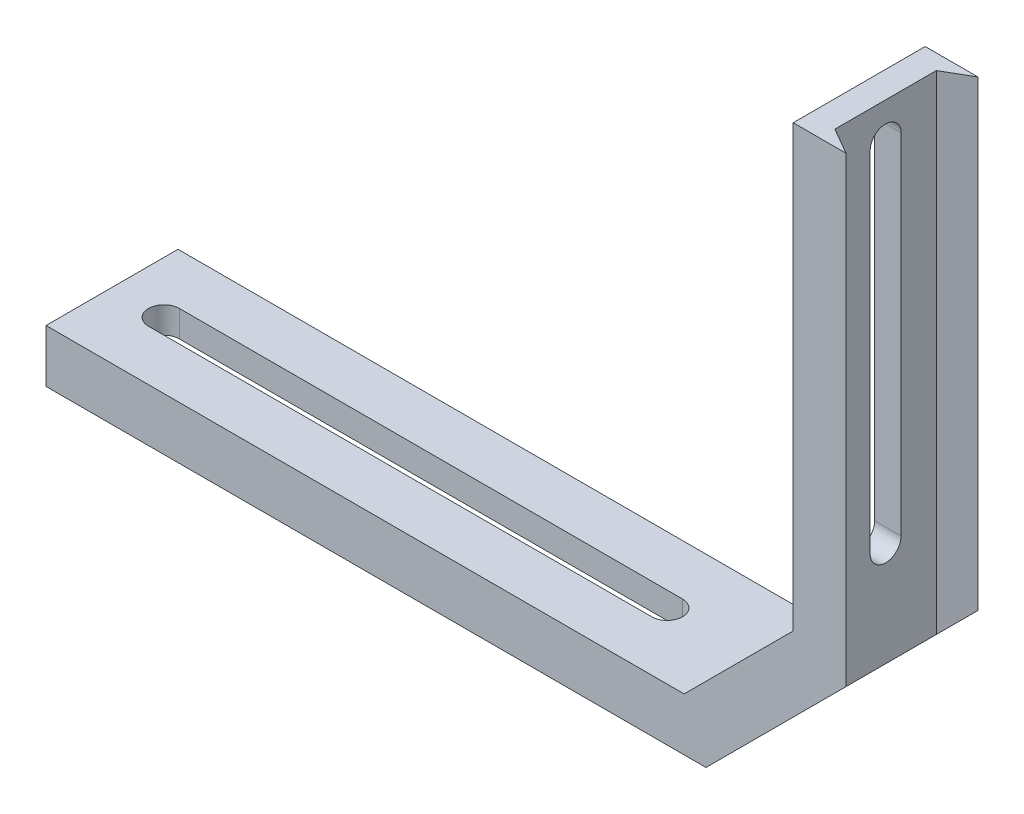
from build123d import *

# Parameters (mm, degrees)
EXTRUDE_1_DEPTH     = 20
CUT_EXTRUDE_3_DEPTH = 149.381528207
CUT_EXTRUDE_4_DEPTH = 154.011402085
CUT_EXTRUDE_5_DEPTH = 149.381528207
CUT_EXTRUDE_6_DEPTH = 142.921339686


with BuildPart() as part:
    # Эскиз1 → Бобышка-Вытянуть1 (new body)
    with BuildSketch(Plane.XY):
        Polygon((0, 0), (0, -8), (100, -8), (121.213203436, 13.213203436), (121.213203436, 83.213203436), (113.213203436, 83.213203436), (113.213203436, 16.526911935), (96.686291501, 0), align=None)
    extrude(amount=EXTRUDE_1_DEPTH)

    # Эскиз4 → Вырез-Вытянуть3 (cut, through all)
    with BuildSketch(Plane.ZY):
        Polygon((0, -8), (2.309401077, -4), (17.690598923, -4), (20, -8), align=None)
    extrude(amount=-CUT_EXTRUDE_3_DEPTH, mode=Mode.SUBTRACT)

    # Эскиз5 → Вырез-Вытянуть4 (cut, through all)
    with BuildSketch(Plane(origin=(0, 83.213203436, 0), x_dir=(1, 0, 0), z_dir=(0, 1, 0))):
        Polygon((121.213203436, 0), (117.213203436, -2.309401077), (117.213203436, -17.690598923), (121.213203436, -20), align=None)
    extrude(amount=-CUT_EXTRUDE_4_DEPTH, mode=Mode.SUBTRACT)

    # Эскиз6 → Вырез-Вытянуть5 (cut, through all)
    with BuildSketch(Plane(origin=(0, 0, 0), x_dir=(1, 0, 0), z_dir=(0, 1, 0))):
        with BuildLine():
            Line((7.870014132, -7.663568904), (84.104423022, -7.663568904))
            ThreePointArc((84.104423022, -7.663568904), (86.440854117, -10), (84.104423022, -12.336431096))
            Line((84.104423022, -12.336431096), (7.870014132, -12.336431096))
            ThreePointArc((7.870014132, -12.336431096), (5.533583037, -10), (7.870014132, -7.663568904))
        make_face()
    extrude(amount=-CUT_EXTRUDE_5_DEPTH, mode=Mode.SUBTRACT)

    # Эскиз7 → Вырез-Вытянуть6 (cut, through all)
    with BuildSketch(Plane.ZY.offset(-113.213203436)):
        with BuildLine():
            Line((12.340286207, 77.716506994), (12.340286207, 24.800035528))
            ThreePointArc((12.340286207, 24.800035528), (10, 22.45974932), (7.659713793, 24.800035528))
            Line((7.659713793, 24.800035528), (7.659713793, 77.716506994))
            ThreePointArc((7.659713793, 77.716506994), (10, 80.056793201), (12.340286207, 77.716506994))
        make_face()
    extrude(amount=-CUT_EXTRUDE_6_DEPTH, mode=Mode.SUBTRACT)


solid = part.part
